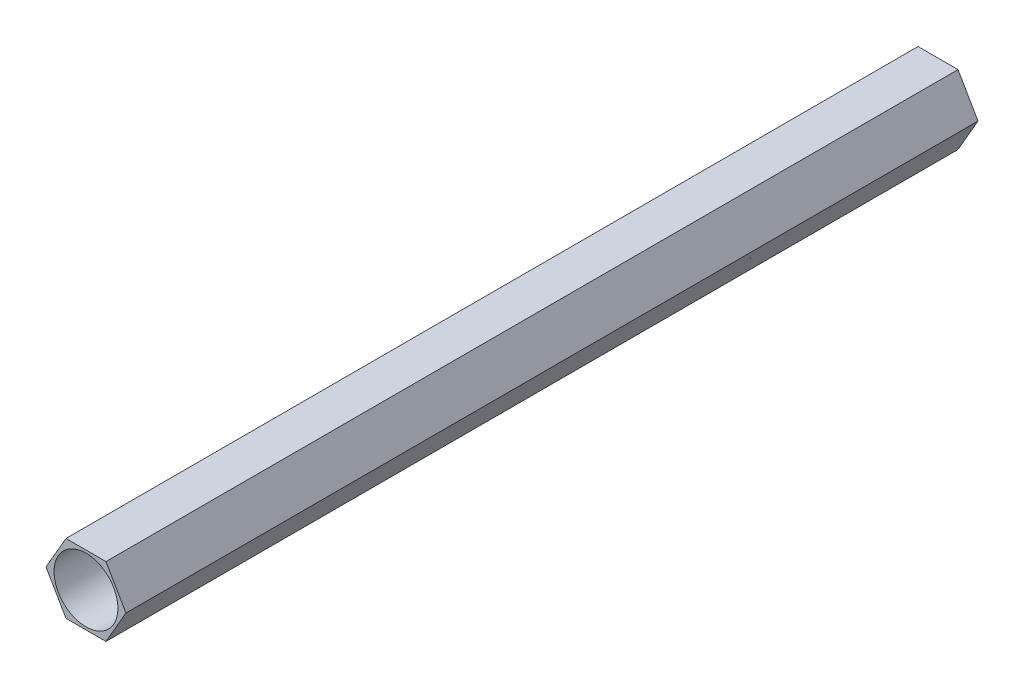
from build123d import *

# Parameters (mm, degrees)
BOSS_EXTRUDE1_DEPTH = 40
SKETCH3_R           = 1.5
CUT_EXTRUDE3_DEPTH  = 25
CUT_EXTRUDE4_START  = -25
SKETCH4_R           = 1.5
CUT_EXTRUDE4_DEPTH  = 25


with BuildPart() as part:
    # Sketch1 → Boss-Extrude1 (new body)
    with BuildSketch(Plane.XY):
        Polygon((1.876388375, 0), (0.938194187, 1.625), (-0.938194187, 1.625), (-1.876388375, 0), (-0.938194187, -1.625), (0.938194187, -1.625), align=None)
    extrude(amount=BOSS_EXTRUDE1_DEPTH)

    # Sketch3 → Cut-Extrude3 (cut)
    with BuildSketch(Plane.XY.offset(40)):
        Circle(SKETCH3_R)
    extrude(amount=-CUT_EXTRUDE3_DEPTH, mode=Mode.SUBTRACT)

    # Sketch4 → Cut-Extrude4 (cut)
    with BuildSketch(Plane(origin=(0, 0, 0), x_dir=(-1, 0, 0), z_dir=(0, 0, -1)).offset(CUT_EXTRUDE4_START)):
        with Locations(Location((0, 0, 0), (0, 0, 180))):
            Circle(SKETCH4_R)
    extrude(amount=CUT_EXTRUDE4_DEPTH, mode=Mode.SUBTRACT)


solid = part.part
